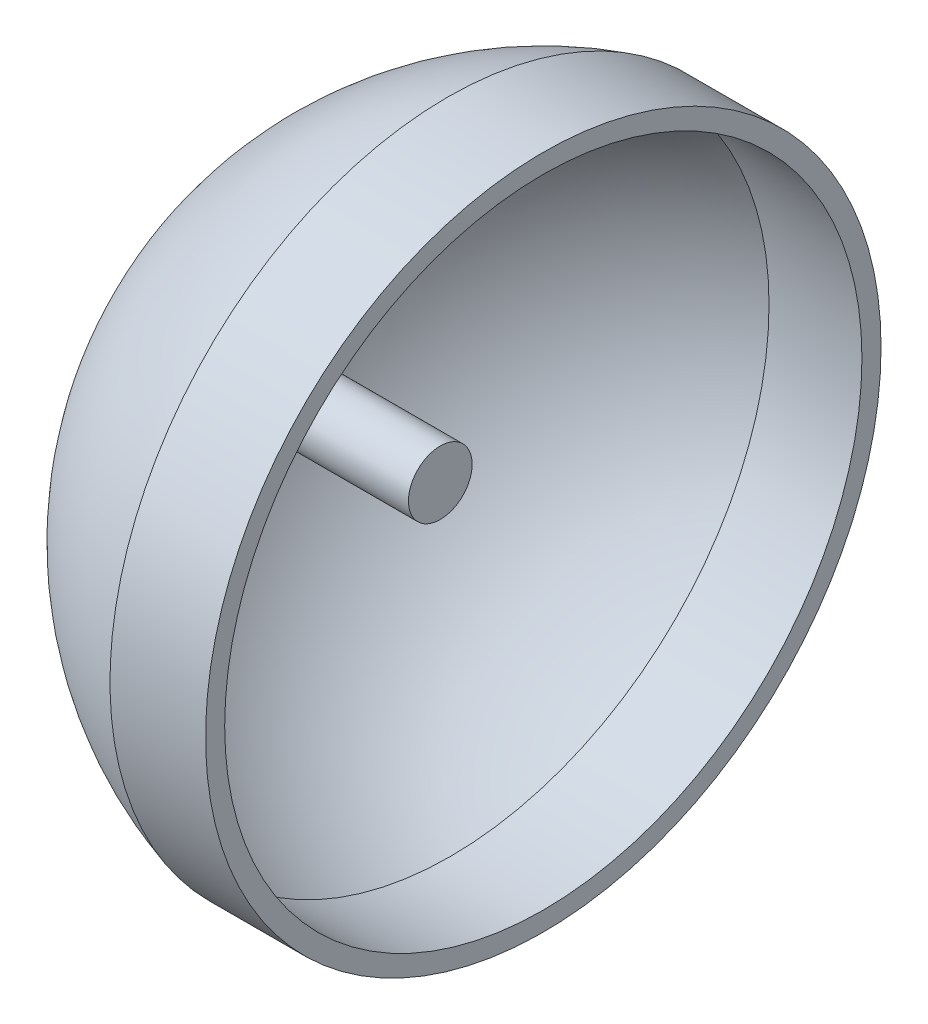
from build123d import *

# Parameters (mm, degrees)
SHELL1_T            = -3
SKETCH3_R           = 5
BOSS_EXTRUDE1_DEPTH = 30


with BuildPart() as part:
    # Sketch2 → Revolve1 (revolve)
    with BuildSketch(Plane.XY, mode=Mode.PRIVATE) as revolve1_sk:
        with BuildLine():
            Line((0, 0), (0, 53))
            Line((0, 53), (-15, 53))
            ThreePointArc((-15, 53), (-40.721592269, 37.091129978), (-54.166410256, 10))
            Line((-54.166410256, 10), (-49.166410256, 10))
            Line((-49.166410256, 10), (-49.166410256, 0))
            Line((-49.166410256, 0), (0, 0))
        make_face()
    revolve(revolve1_sk.sketch.rotate(Axis((0, 0, 0), (-1, 0, 0)), 90), axis=Axis((0, 0, 0), (-1, 0, 0)))

    # Shell1
    shell1_openings = [part.faces().sort_by_distance(p)[0] for p in [
        (0, 0, 0),
    ]]
    offset(amount=SHELL1_T, openings=shell1_openings, kind=Kind.INTERSECTION)

    # Sketch3 → Boss-Extrude1 (add)
    with BuildSketch(Plane(origin=(-46.166410256, 0, 0), x_dir=(0, 0, -1), z_dir=(1, 0, 0))):
        Circle(SKETCH3_R)
    extrude(amount=BOSS_EXTRUDE1_DEPTH)


solid = part.part
